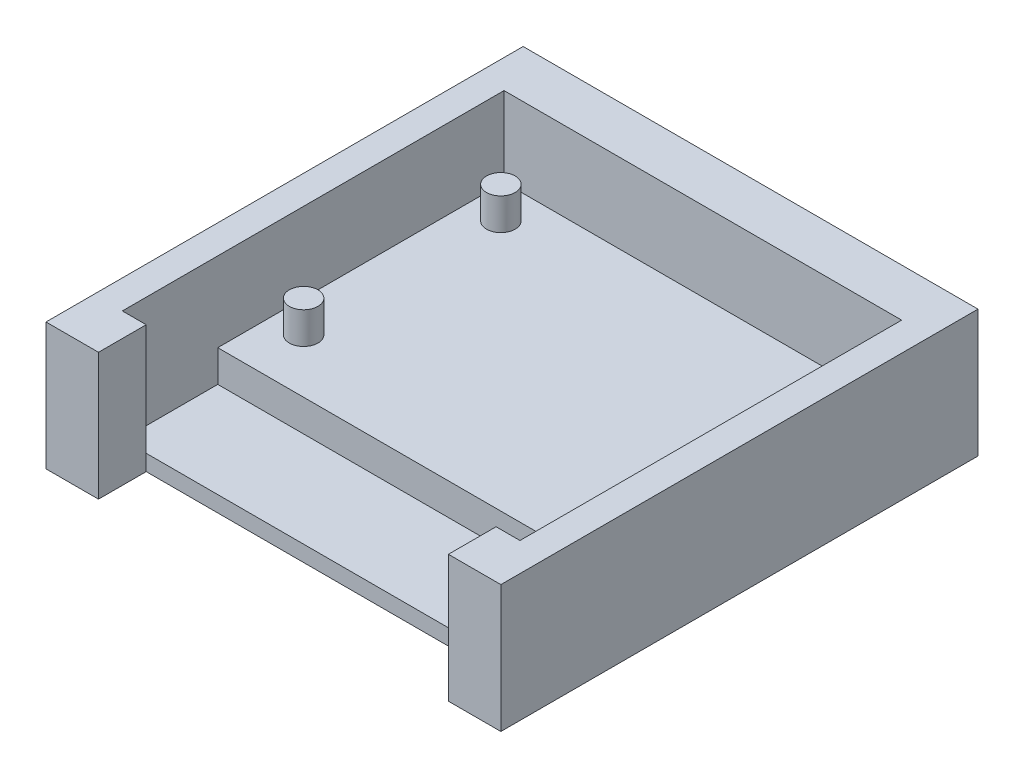
from build123d import *

# Parameters (mm, degrees)
SKETCH_1_W          = 28.6
SKETCH_1_H          = 30
EXTRUDE_1_DEPTH     = 3
SKETCH_1_4_W        = 28.6
SKETCH_1_4_H        = 30
SKETCH_1_4_W_2      = 25
SKETCH_1_4_H_2      = 24
EXTRUDE_2_DEPTH     = 8
SKETCH_2_W          = 22
SKETCH_2_H          = 3
CUT_EXTRUDE_1_DEPTH = 8
SKETCH_3_W          = 25
SKETCH_3_H          = 6
CUT_EXTRUDE_2_DEPTH = 2
SKETCH_4_R          = 0.9
EXTRUDE_3_DEPTH     = 2


with BuildPart() as part:
    # 草图1 → 凸台-拉伸1 (new body)
    with BuildSketch(Plane(origin=(0, 0, 0), x_dir=(1, 0, 0), z_dir=(0, 1, 0))):
        Rectangle(SKETCH_1_W, SKETCH_1_H)
    extrude(amount=EXTRUDE_1_DEPTH)

    # 草图1<4> → 凸台-拉伸2 (add)
    with BuildSketch(Plane(origin=(0, 0, 0), x_dir=(1, 0, 0), z_dir=(0, 1, 0))):
        Rectangle(SKETCH_1_4_W, SKETCH_1_4_H)
        Rectangle(SKETCH_1_4_W_2, SKETCH_1_4_H_2, mode=Mode.SUBTRACT)
    extrude(amount=EXTRUDE_2_DEPTH)

    # 草图2 → 切除-拉伸1 (cut)
    with BuildSketch(Plane(origin=(0, 8, 0), x_dir=(1, 0, 0), z_dir=(0, 1, 0))):
        with Locations((0, -13.5)):
            Rectangle(SKETCH_2_W, SKETCH_2_H)
    extrude(amount=-CUT_EXTRUDE_1_DEPTH, mode=Mode.SUBTRACT)

    # 草图3 → 切除-拉伸2 (cut)
    with BuildSketch(Plane(origin=(0, 3, 0), x_dir=(1, 0, 0), z_dir=(0, 1, 0))):
        with Locations((0, -9)):
            Rectangle(SKETCH_3_W, SKETCH_3_H)
    extrude(amount=-CUT_EXTRUDE_2_DEPTH, mode=Mode.SUBTRACT)

    # 草图4 → 凸台-拉伸3 (add)
    with BuildSketch(Plane(origin=(0, 3, 0), x_dir=(1, 0, 0), z_dir=(0, 1, 0))):
        with Locations((-10.5, 9.8)):
            Circle(SKETCH_4_R)
        with Locations((-10.5, -2.6)):
            Circle(SKETCH_4_R)
        with Locations((10.5, 9.8)):
            Circle(SKETCH_4_R)
        with Locations((10.5, -2.6)):
            Circle(SKETCH_4_R)
    extrude(amount=EXTRUDE_3_DEPTH)


solid = part.part
